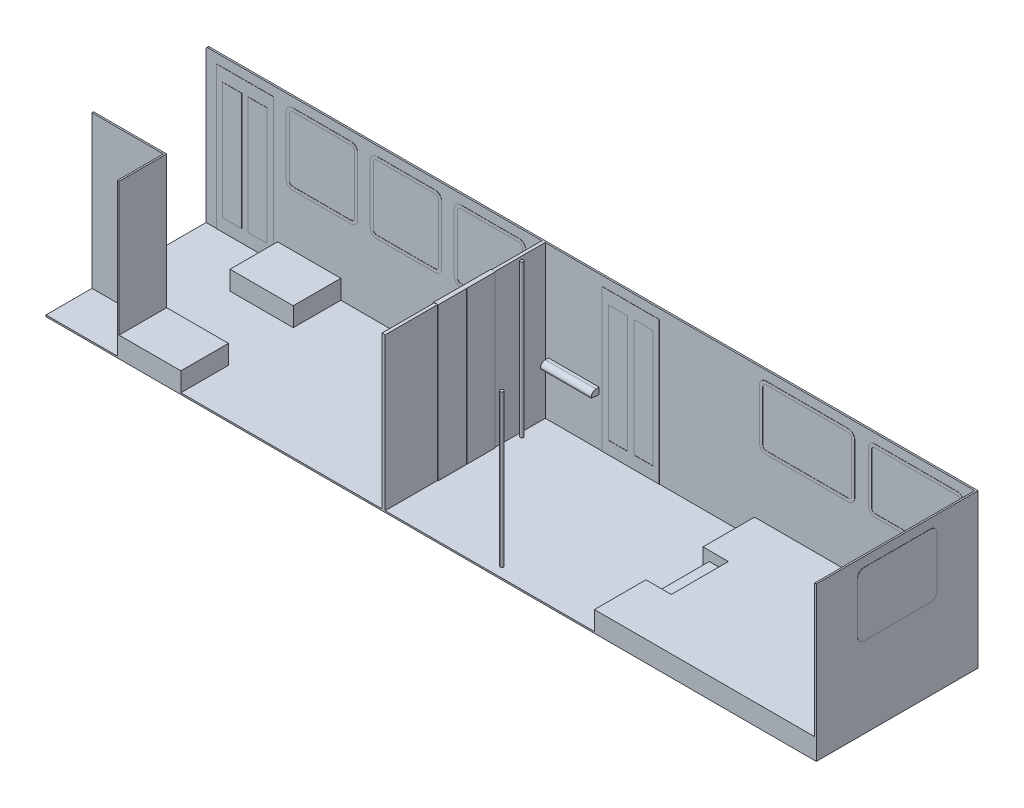
from build123d import *

# Parameters (mm, degrees)
SKETCH2_W            = 12344.4
SKETCH2_H            = 2590.8
BOSS_EXTRUDE1_DEPTH  = 25.4
SKETCH3_W            = 50.8
SKETCH3_H            = 2590.8
BOSS_EXTRUDE2_DEPTH  = 2440.94
BOSS_EXTRUDE4_START  = 10.16
SKETCH4_W            = 914.4
SKETCH4_H            = 2440.94
BOSS_EXTRUDE4_DEPTH  = 71.12
CUT_EXTRUDE1_DEPTH   = 5.08
CUT_EXTRUDE2_START   = -66.04
SKETCH6_W            = 12.7
SKETCH6_H            = 2440.94
CUT_EXTRUDE2_DEPTH   = 5.08
SKETCH8_W            = 71.12
SKETCH8_H            = 914.4
BOSS_EXTRUDE5_DEPTH  = 2.54
SKETCH9_W            = 50.8
SKETCH9_H            = 2440.94
CUT_EXTRUDE4_DEPTH   = 25.4
SKETCH11_W           = 12344.4
SKETCH11_H           = 25.4
BOSS_EXTRUDE6_DEPTH  = 2438.4
FILLET1_R            = 25.4
BOSS_EXTRUDE7_START  = 2.54
SKETCH12_W           = 914.4
SKETCH12_H           = 2286
BOSS_EXTRUDE7_DEPTH  = 30.48
SKETCH13_W           = 304.8
SKETCH13_H           = 1879.6
CUT_EXTRUDE5_DEPTH   = 99.06
BOSS_EXTRUDE9_START  = 2.54
SKETCH17_W           = 304.8
SKETCH17_H           = 1879.6
BOSS_EXTRUDE9_DEPTH  = 25.4
SKETCH20_W           = 3556
SKETCH20_H           = 2565.4
BOSS_EXTRUDE10_DEPTH = 304.8
SKETCH21_W           = 914.4
SKETCH21_H           = 304.8
CUT_EXTRUDE6_DEPTH   = 101.6
SKETCH22_W           = 914.4
SKETCH22_H           = 152.4
CUT_EXTRUDE7_DEPTH   = 304.8
BOSS_EXTRUDE12_START = 2.54
SKETCH25_W           = 914.4
SKETCH25_H           = 2286
SKETCH25_W_2         = 304.8
SKETCH25_H_2         = 1879.6
BOSS_EXTRUDE12_DEPTH = 27.94
BOSS_EXTRUDE13_START = -2.54
SKETCH27_W           = 304.8
SKETCH27_H           = 1879.6
BOSS_EXTRUDE13_DEPTH = 27.94
BOSS_EXTRUDE17_DEPTH = 127
FILLET3_R            = 76.2
CHAMFER2_SIZE        = 101.6
CHAMFER2_SIZE2       = 12.7
SKETCH31_R           = 25.4
BOSS_EXTRUDE18_DEPTH = 2438.4
BOSS_EXTRUDE19_START = 2.54
BOSS_EXTRUDE19_DEPTH = 30.48
CUT_EXTRUDE8_DEPTH   = 2.54
BOSS_EXTRUDE22_START = 2.54
BOSS_EXTRUDE22_DEPTH = 30.48
CUT_EXTRUDE10_DEPTH  = 2.54
SKETCH38_R           = 25.4
BOSS_EXTRUDE23_DEPTH = 2438.4
SKETCH39_W           = 1013.196669231
SKETCH39_H           = 762
SKETCH39_W_2         = 1016
BOSS_EXTRUDE24_DEPTH = 304.8
SKETCH41_W           = 25.4
SKETCH41_H           = 762
BOSS_EXTRUDE25_DEPTH = 2133.6
SKETCH42_W           = 1145.803330769
SKETCH42_H           = 25.4
BOSS_EXTRUDE26_DEPTH = 2438.4
SKETCH43_W           = 25.4
SKETCH43_H           = 2565.4
BOSS_EXTRUDE27_DEPTH = 2133.6
BOSS_EXTRUDE28_START = 2.54
BOSS_EXTRUDE28_DEPTH = 30.48
CUT_EXTRUDE11_DEPTH  = 2.54


with BuildPart() as part:
    # Sketch2 → Boss-Extrude1 (new body)
    with BuildSketch(Plane(origin=(0, 0, 0), x_dir=(1, 0, 0), z_dir=(0, 1, 0))):
        Rectangle(SKETCH2_W, SKETCH2_H)
    extrude(amount=BOSS_EXTRUDE1_DEPTH)

    # Sketch3 → Boss-Extrude2 (add)
    with BuildSketch(Plane(origin=(0, 25.4, 0), x_dir=(1, 0, 0), z_dir=(0, 1, 0))):
        with Locations((-762, 0)):
            Rectangle(SKETCH3_W, SKETCH3_H)
    extrude(amount=BOSS_EXTRUDE2_DEPTH)



with BuildPart() as body_2:
    # Sketch4 → Boss-Extrude4 (new body)
    with BuildSketch(Plane(origin=(-736.6, 0, 0), x_dir=(0, 0, -1), z_dir=(1, 0, 0)).offset(BOSS_EXTRUDE4_START)):
        with Locations((0, 1245.87)):
            Rectangle(SKETCH4_W, SKETCH4_H)
    extrude(amount=-BOSS_EXTRUDE4_DEPTH)

    # Sketch5 → Cut-Extrude1 (cut)
    with BuildSketch(Plane(origin=(-726.44, 0, 0), x_dir=(0, 0, -1), z_dir=(1, 0, 0))):
        Polygon((0, 25.4), (-6.35, 25.4), (-6.35, 2466.34), (0, 2466.34), (6.35, 2466.34), (6.35, 25.4), align=None)
    extrude(amount=-CUT_EXTRUDE1_DEPTH, mode=Mode.SUBTRACT)

    # Sketch6 → Cut-Extrude2 (cut)
    with BuildSketch(Plane(origin=(-731.52, 0, 0), x_dir=(0, 0, -1), z_dir=(1, 0, 0)).offset(CUT_EXTRUDE2_START)):
        with Locations((0, 1245.87)):
            Rectangle(SKETCH6_W, SKETCH6_H)
    extrude(amount=CUT_EXTRUDE2_DEPTH, mode=Mode.SUBTRACT)


with BuildPart() as part_1:
    add(part.part)

    add(body_2.part)  # Boss-Extrude5 merges body 2
    # Sketch8 → Boss-Extrude5 (add)
    with BuildSketch(Plane(origin=(0, 2466.34, 0), x_dir=(1, 0, 0), z_dir=(0, 1, 0))):
        with Locations((-762, 0)):
            Rectangle(SKETCH8_W, SKETCH8_H)
    extrude(amount=BOSS_EXTRUDE5_DEPTH)

    # Sketch9 → Cut-Extrude4 (cut)
    with BuildSketch(Plane(origin=(0, 0, -1295.4), x_dir=(-1, 0, 0), z_dir=(0, 0, -1))):
        with Locations((762, 1245.87)):
            Rectangle(SKETCH9_W, SKETCH9_H)
    extrude(amount=-CUT_EXTRUDE4_DEPTH, mode=Mode.SUBTRACT)

    # Sketch11 → Boss-Extrude6 (add)
    with BuildSketch(Plane(origin=(0, 25.4, 0), x_dir=(1, 0, 0), z_dir=(0, 1, 0))):
        with Locations((0, 1282.7)):
            Rectangle(SKETCH11_W, SKETCH11_H)
    extrude(amount=BOSS_EXTRUDE6_DEPTH)

    # Fillet1
    fillet1_edges = [part_1.edges().sort_by_distance(p)[0] for p in [
        (-6172.2, 2463.8, -1282.7),
    ]]
    fillet(fillet1_edges, radius=FILLET1_R)



with BuildPart() as body_2_2:
    # Sketch12 → Boss-Extrude7 (new body)
    with BuildSketch(Plane.XY.offset(-1270).offset(BOSS_EXTRUDE7_START)):
        with Locations((-5546.504098629, 1168.4)):
            Rectangle(SKETCH12_W, SKETCH12_H)
    extrude(amount=-BOSS_EXTRUDE7_DEPTH)

    # Sketch13 → Cut-Extrude5 (cut)
    with BuildSketch(Plane.XY.offset(-1267.46)):
        with Locations((-5749.704098629, 1168.4)):
            Rectangle(SKETCH13_W, SKETCH13_H)
        with Locations((-5343.304098629, 1168.4)):
            Rectangle(SKETCH13_W, SKETCH13_H)
    extrude(amount=-CUT_EXTRUDE5_DEPTH, mode=Mode.SUBTRACT)


with BuildPart() as part_2:
    add(part_1.part)

    add(body_2_2.part)  # Boss-Extrude9 merges body 2 2
    # Sketch17 → Boss-Extrude9 (add)
    with BuildSketch(Plane.XY.offset(-1267.46).offset(BOSS_EXTRUDE9_START)):
        with Locations((-5749.704098629, 1168.4)):
            Rectangle(SKETCH17_W, SKETCH17_H)
        with Locations((-5343.304098629, 1168.4)):
            Rectangle(SKETCH17_W, SKETCH17_H)
    extrude(amount=-BOSS_EXTRUDE9_DEPTH)

    # Sketch20 → Boss-Extrude10 (add)
    with BuildSketch(Plane(origin=(0, 25.4, 0), x_dir=(1, 0, 0), z_dir=(0, 1, 0))):
        with Locations((4394.2, -12.7)):
            Rectangle(SKETCH20_W, SKETCH20_H)
    extrude(amount=BOSS_EXTRUDE10_DEPTH)

    # Sketch21 → Cut-Extrude6 (cut)
    with BuildSketch(Plane.ZY.offset(-2616.2)):
        with Locations((12.7, 177.8)):
            Rectangle(SKETCH21_W, SKETCH21_H)
    extrude(amount=-CUT_EXTRUDE6_DEPTH, mode=Mode.SUBTRACT)

    # Sketch22 → Cut-Extrude7 (cut)
    with BuildSketch(Plane.ZY.offset(-2717.8)):
        with Locations((12.7, 254)):
            Rectangle(SKETCH22_W, SKETCH22_H)
    extrude(amount=-CUT_EXTRUDE7_DEPTH, mode=Mode.SUBTRACT)



with BuildPart() as body_2_3:
    # Sketch25 → Boss-Extrude12 (new body)
    with BuildSketch(Plane.XY.offset(-1270).offset(BOSS_EXTRUDE12_START)):
        with Locations((635, 1168.4)):
            Rectangle(SKETCH25_W, SKETCH25_H)
        with Locations((431.8, 1168.4)):
            Rectangle(SKETCH25_W_2, SKETCH25_H_2, mode=Mode.SUBTRACT)
        with Locations((838.2, 1168.4)):
            Rectangle(SKETCH25_W_2, SKETCH25_H_2, mode=Mode.SUBTRACT)
    extrude(amount=-BOSS_EXTRUDE12_DEPTH)


with BuildPart() as part_3:
    add(part_2.part)

    add(body_2_3.part)  # Boss-Extrude13 merges body 2 3
    # Sketch27 → Boss-Extrude13 (add)
    with BuildSketch(Plane.XY.offset(-1267.46).offset(BOSS_EXTRUDE13_START)):
        with Locations((431.8, 1168.4)):
            Rectangle(SKETCH27_W, SKETCH27_H)
    extrude(amount=-BOSS_EXTRUDE13_DEPTH)

    # Sketch28 → Boss-Extrude17 (add)
    with BuildSketch(Plane.XY.offset(-1270)):
        Polygon((127, 889), (-685.8, 889), (-685.8, 787.4), (-401.010587735, 787.4), (127, 787.4), align=None)
    extrude(amount=BOSS_EXTRUDE17_DEPTH)

    # Fillet3
    fillet3_edges = [part_3.edges().sort_by_distance(p)[0] for p in [
        (-279.4, 889, -1143),
    ]]
    fillet(fillet3_edges, radius=FILLET3_R)

    # Chamfer2
    chamfer2_edges = [part_3.edges().sort_by_distance(p)[0] for p in [
        (-279.4, 787.4, -1143),
    ]]
    chamfer2_side = [part_3.faces().sort_by_distance(p)[0] for p in [
        (-279.4, 787.4, -1206.5),
    ]]
    chamfer(chamfer2_edges, length=CHAMFER2_SIZE, length2=CHAMFER2_SIZE2, reference=chamfer2_side[0])

    # Sketch31 → Boss-Extrude18 (add)
    with BuildSketch(Plane(origin=(0, 25.4, 0), x_dir=(1, 0, 0), z_dir=(0, 1, 0))):
        with Locations(Location((-670.554621651, 827.918015875, 0), (0, 0, 90))):
            Circle(SKETCH31_R)
    extrude(amount=BOSS_EXTRUDE18_DEPTH)

    # Sketch32 → Boss-Extrude19 (add)
    # profile 1 of 3: a face of its own
    with BuildSketch(Plane.XY.offset(-1270).offset(BOSS_EXTRUDE19_START)):
        with BuildLine():
            Line((-4784.504098629, 2311.4), (-3844.704098629, 2311.4))
            ThreePointArc((-3844.704098629, 2311.4), (-3772.86204966, 2281.642048969), (-3743.104098629, 2209.8))
            Line((-3743.104098629, 2209.8), (-3743.104098629, 1270))
            ThreePointArc((-3743.104098629, 1270), (-3772.86204966, 1198.157951031), (-3844.704098629, 1168.4))
            Line((-3844.704098629, 1168.4), (-4784.504098629, 1168.4))
            ThreePointArc((-4784.504098629, 1168.4), (-4856.346147597, 1198.157951031), (-4886.104098629, 1270))
            Line((-4886.104098629, 1270), (-4886.104098629, 2209.8))
            ThreePointArc((-4886.104098629, 2209.8), (-4856.346147597, 2281.642048969), (-4784.504098629, 2311.4))
        make_face()
    # profile 2 of 3: a face of its own
    with BuildSketch(Plane.XY.offset(-1270).offset(BOSS_EXTRUDE19_START)):
        with BuildLine():
            Line((-3438.304098629, 1168.4), (-2498.504098629, 1168.4))
            ThreePointArc((-2498.504098629, 1168.4), (-2426.66204966, 1198.157951031), (-2396.904098629, 1270))
            Line((-2396.904098629, 1270), (-2396.904098629, 2209.8))
            ThreePointArc((-2396.904098629, 2209.8), (-2426.66204966, 2281.642048969), (-2498.504098629, 2311.4))
            Line((-2498.504098629, 2311.4), (-3438.304098629, 2311.4))
            ThreePointArc((-3438.304098629, 2311.4), (-3510.146147597, 2281.642048969), (-3539.904098629, 2209.8))
            Line((-3539.904098629, 2209.8), (-3539.904098629, 1270))
            ThreePointArc((-3539.904098629, 1270), (-3510.146147597, 1198.157951031), (-3438.304098629, 1168.4))
        make_face()
        with BuildLine():
            Line((-3489.104098629, 1270), (-3489.104098629, 2209.8))
            ThreePointArc((-3489.104098629, 2209.8), (-3474.225123113, 2245.721024484), (-3438.304098629, 2260.6))
            Line((-3438.304098629, 2260.6), (-2498.504098629, 2260.6))
            ThreePointArc((-2498.504098629, 2260.6), (-2462.583074144, 2245.721024484), (-2447.704098629, 2209.8))
            Line((-2447.704098629, 2209.8), (-2447.704098629, 1270))
            ThreePointArc((-2447.704098629, 1270), (-2462.583074144, 1234.078975516), (-2498.504098629, 1219.2))
            Line((-2498.504098629, 1219.2), (-3438.304098629, 1219.2))
            ThreePointArc((-3438.304098629, 1219.2), (-3474.225123113, 1234.078975516), (-3489.104098629, 1270))
        make_face(mode=Mode.SUBTRACT)
    # profile 3 of 3: a face of its own
    with BuildSketch(Plane.XY.offset(-1270).offset(BOSS_EXTRUDE19_START)):
        with BuildLine():
            Line((-2092.104098629, 1168.4), (-1152.304098629, 1168.4))
            ThreePointArc((-1152.304098629, 1168.4), (-1080.46204966, 1198.157951031), (-1050.704098629, 1270))
            Line((-1050.704098629, 1270), (-1050.704098629, 2209.8))
            ThreePointArc((-1050.704098629, 2209.8), (-1080.46204966, 2281.642048969), (-1152.304098629, 2311.4))
            Line((-1152.304098629, 2311.4), (-2092.104098629, 2311.4))
            ThreePointArc((-2092.104098629, 2311.4), (-2163.946147597, 2281.642048969), (-2193.704098629, 2209.8))
            Line((-2193.704098629, 2209.8), (-2193.704098629, 1270))
            ThreePointArc((-2193.704098629, 1270), (-2163.946147597, 1198.157951031), (-2092.104098629, 1168.4))
        make_face()
        with BuildLine():
            Line((-2142.904098629, 1270), (-2142.904098629, 2209.8))
            ThreePointArc((-2142.904098629, 2209.8), (-2128.025123113, 2245.721024484), (-2092.104098629, 2260.6))
            Line((-2092.104098629, 2260.6), (-1152.304098629, 2260.6))
            ThreePointArc((-1152.304098629, 2260.6), (-1116.383074144, 2245.721024484), (-1101.504098629, 2209.8))
            Line((-1101.504098629, 2209.8), (-1101.504098629, 1270))
            ThreePointArc((-1101.504098629, 1270), (-1116.383074144, 1234.078975516), (-1152.304098629, 1219.2))
            Line((-1152.304098629, 1219.2), (-2092.104098629, 1219.2))
            ThreePointArc((-2092.104098629, 1219.2), (-2128.025123113, 1234.078975516), (-2142.904098629, 1270))
        make_face(mode=Mode.SUBTRACT)
    extrude(amount=-BOSS_EXTRUDE19_DEPTH)

    # Sketch34 → Cut-Extrude8 (cut)
    with BuildSketch(Plane.XY.offset(-1267.46)):
        with BuildLine():
            Line((-4835.304098629, 2209.8), (-4835.304098629, 1270))
            ThreePointArc((-4835.304098629, 1270), (-4820.425123113, 1234.078975516), (-4784.504098629, 1219.2))
            Line((-4784.504098629, 1219.2), (-3844.704098629, 1219.2))
            ThreePointArc((-3844.704098629, 1219.2), (-3808.783074144, 1234.078975516), (-3793.904098629, 1270))
            Line((-3793.904098629, 1270), (-3793.904098629, 2209.8))
            ThreePointArc((-3793.904098629, 2209.8), (-3808.783074144, 2245.721024484), (-3844.704098629, 2260.6))
            Line((-3844.704098629, 2260.6), (-4784.504098629, 2260.6))
            ThreePointArc((-4784.504098629, 2260.6), (-4820.425123113, 2245.721024484), (-4835.304098629, 2209.8))
        make_face()
    extrude(amount=-CUT_EXTRUDE8_DEPTH, mode=Mode.SUBTRACT)

    # Sketch35 → Boss-Extrude22 (add)
    with BuildSketch(Plane.XY.offset(-1270).offset(BOSS_EXTRUDE22_START)):
        with BuildLine():
            Line((5867.4, 2311.4), (4546.6, 2311.4))
            ThreePointArc((4546.6, 2311.4), (4474.757951031, 2281.642048969), (4445, 2209.8))
            Line((4445, 2209.8), (4445, 1397))
            ThreePointArc((4445, 1397), (4474.757951031, 1325.157951031), (4546.6, 1295.4))
            Line((4546.6, 1295.4), (5867.4, 1295.4))
            ThreePointArc((5867.4, 1295.4), (5939.242048969, 1325.157951031), (5969, 1397))
            Line((5969, 1397), (5969, 2209.8))
            ThreePointArc((5969, 2209.8), (5939.242048969, 2281.642048969), (5867.4, 2311.4))
        make_face()
        with BuildLine():
            Line((4122.185317375, 1295.4), (2801.385317375, 1295.4))
            ThreePointArc((2801.385317375, 1295.4), (2729.543268406, 1325.157951031), (2699.785317375, 1397))
            Line((2699.785317375, 1397), (2699.785317375, 2209.8))
            ThreePointArc((2699.785317375, 2209.8), (2729.543268406, 2281.642048969), (2801.385317375, 2311.4))
            Line((2801.385317375, 2311.4), (4122.185317375, 2311.4))
            ThreePointArc((4122.185317375, 2311.4), (4194.027366344, 2281.642048969), (4223.785317375, 2209.8))
            Line((4223.785317375, 2209.8), (4223.785317375, 1397))
            ThreePointArc((4223.785317375, 1397), (4194.027366344, 1325.157951031), (4122.185317375, 1295.4))
        make_face()
    extrude(amount=-BOSS_EXTRUDE22_DEPTH)

    # Sketch37 → Cut-Extrude10 (cut)
    with BuildSketch(Plane.XY.offset(-1267.46)):
        with BuildLine():
            Line((4546.6, 1346.2), (5867.4, 1346.2))
            ThreePointArc((5867.4, 1346.2), (5903.321024484, 1361.078975516), (5918.2, 1397))
            Line((5918.2, 1397), (5918.2, 2209.8))
            ThreePointArc((5918.2, 2209.8), (5903.321024484, 2245.721024484), (5867.4, 2260.6))
            Line((5867.4, 2260.6), (4546.6, 2260.6))
            ThreePointArc((4546.6, 2260.6), (4510.678975516, 2245.721024484), (4495.8, 2209.8))
            Line((4495.8, 2209.8), (4495.8, 1397))
            ThreePointArc((4495.8, 1397), (4510.678975516, 1361.078975516), (4546.6, 1346.2))
        make_face()
        with BuildLine():
            ThreePointArc((4172.985317375, 2209.8), (4158.106341859, 2245.721024484), (4122.185317375, 2260.6))
            Line((4122.185317375, 2260.6), (2801.385317375, 2260.6))
            ThreePointArc((2801.385317375, 2260.6), (2765.464292891, 2245.721024484), (2750.585317375, 2209.8))
            Line((2750.585317375, 2209.8), (2750.585317375, 1397))
            ThreePointArc((2750.585317375, 1397), (2765.464292891, 1361.078975516), (2801.385317375, 1346.2))
            Line((2801.385317375, 1346.2), (4122.185317375, 1346.2))
            ThreePointArc((4122.185317375, 1346.2), (4158.106341859, 1361.078975516), (4172.985317375, 1397))
            Line((4172.985317375, 1397), (4172.985317375, 2209.8))
        make_face()
    extrude(amount=-CUT_EXTRUDE10_DEPTH, mode=Mode.SUBTRACT)

    # Sketch38 → Boss-Extrude23 (add)
    with BuildSketch(Plane(origin=(0, 25.4, 0), x_dir=(1, 0, 0), z_dir=(0, 1, 0))):
        with Locations(Location((969.651232913, -1131.557385348, 0), (0, 0, 90))):
            Circle(SKETCH38_R)
    extrude(amount=BOSS_EXTRUDE23_DEPTH)

    # Sketch39 → Boss-Extrude24 (add)
    with BuildSketch(Plane(origin=(0, 25.4, 0), x_dir=(1, 0, 0), z_dir=(0, 1, 0))):
        with Locations((-4519.798334616, 889)):
            Rectangle(SKETCH39_W, SKETCH39_H)
        with Locations((-4518.396669231, -914.4)):
            Rectangle(SKETCH39_W_2, SKETCH39_H)
    extrude(amount=BOSS_EXTRUDE24_DEPTH)

    # Sketch43 → Boss-Extrude27 (add)
    with BuildSketch(Plane(origin=(0, 330.2, 0), x_dir=(1, 0, 0), z_dir=(0, 1, 0))):
        with Locations((6159.5, -12.7)):
            Rectangle(SKETCH43_W, SKETCH43_H)
    extrude(amount=BOSS_EXTRUDE27_DEPTH)

    # Sketch44 → Boss-Extrude28 (add)
    with BuildSketch(Plane.ZY.offset(-6146.8).offset(BOSS_EXTRUDE28_START)):
        with BuildLine():
            Line((533.4, 2311.4), (-533.4, 2311.4))
            ThreePointArc((-533.4, 2311.4), (-605.242048969, 2281.642048969), (-635, 2209.8))
            Line((-635, 2209.8), (-635, 1397))
            ThreePointArc((-635, 1397), (-605.242048969, 1325.157951031), (-533.4, 1295.4))
            Line((-533.4, 1295.4), (533.4, 1295.4))
            ThreePointArc((533.4, 1295.4), (605.242048969, 1325.157951031), (635, 1397))
            Line((635, 1397), (635, 2209.8))
            ThreePointArc((635, 2209.8), (605.242048969, 2281.642048969), (533.4, 2311.4))
        make_face()
    extrude(amount=-BOSS_EXTRUDE28_DEPTH)

    # Sketch47 → Cut-Extrude11 (cut)
    with BuildSketch(Plane.ZY.offset(-6144.26)):
        with BuildLine():
            Line((533.4, 2260.6), (-533.4, 2260.6))
            ThreePointArc((-533.4, 2260.6), (-569.321024484, 2245.721024484), (-584.2, 2209.8))
            Line((-584.2, 2209.8), (-584.2, 1397))
            ThreePointArc((-584.2, 1397), (-569.321024484, 1361.078975516), (-533.4, 1346.2))
            Line((-533.4, 1346.2), (533.4, 1346.2))
            ThreePointArc((533.4, 1346.2), (569.321024484, 1361.078975516), (584.2, 1397))
            Line((584.2, 1397), (584.2, 2209.8))
            ThreePointArc((584.2, 2209.8), (569.321024484, 2245.721024484), (533.4, 2260.6))
        make_face()
    extrude(amount=-CUT_EXTRUDE11_DEPTH, mode=Mode.SUBTRACT)


with BuildPart() as body_2_4:
    # Sketch41 → Boss-Extrude25 (new body)
    with BuildSketch(Plane(origin=(0, 330.2, 0), x_dir=(1, 0, 0), z_dir=(0, 1, 0))):
        with Locations((-5013.696669231, -914.4)):
            Rectangle(SKETCH41_W, SKETCH41_H)
    extrude(amount=BOSS_EXTRUDE25_DEPTH)


with BuildPart() as body_3:
    # Sketch42 → Boss-Extrude26 (new body)
    with BuildSketch(Plane(origin=(0, 25.4, 0), x_dir=(1, 0, 0), z_dir=(0, 1, 0))):
        with Locations((-5599.298334616, -546.1)):
            Rectangle(SKETCH42_W, SKETCH42_H)
    extrude(amount=BOSS_EXTRUDE26_DEPTH)


solid = Compound([part_3.part, body_2_4.part, body_3.part])
